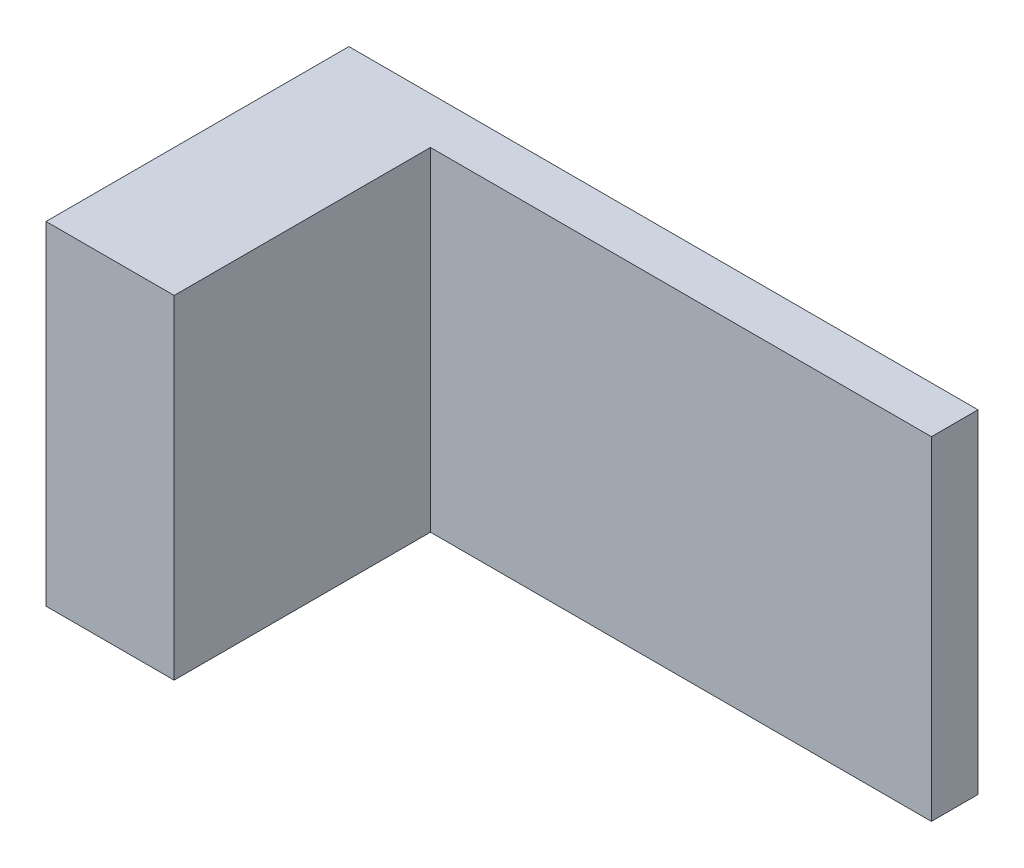
from build123d import *

# Parameters (mm, degrees)
SKETCH1_W           = 27
SKETCH1_H           = 14.3
BOSS_EXTRUDE1_DEPTH = 2
SKETCH2_W           = 5.5
SKETCH2_H           = 14.3
BOSS_EXTRUDE2_DEPTH = 11
SKETCH3_W           = 2.5
SKETCH3_H           = 4.7
BOSS_EXTRUDE3_DEPTH = 1


with BuildPart() as part:
    # Sketch1 → Boss-Extrude1 (new body)
    with BuildSketch(Plane.XY):
        Rectangle(SKETCH1_W, SKETCH1_H)
    extrude(amount=BOSS_EXTRUDE1_DEPTH)

    # Sketch2 → Boss-Extrude2 (add)
    with BuildSketch(Plane.XY.offset(2)):
        with Locations((-10.75, 0)):
            Rectangle(SKETCH2_W, SKETCH2_H)
    extrude(amount=BOSS_EXTRUDE2_DEPTH)

    # Sketch3 → Boss-Extrude3 (add)
    with BuildSketch(Plane(origin=(0, 0, 0), x_dir=(-1, 0, 0), z_dir=(0, 0, -1))):
        with Locations((-8.15, 0)):
            Rectangle(SKETCH3_W, SKETCH3_H)
    extrude(amount=BOSS_EXTRUDE3_DEPTH)


solid = part.part
